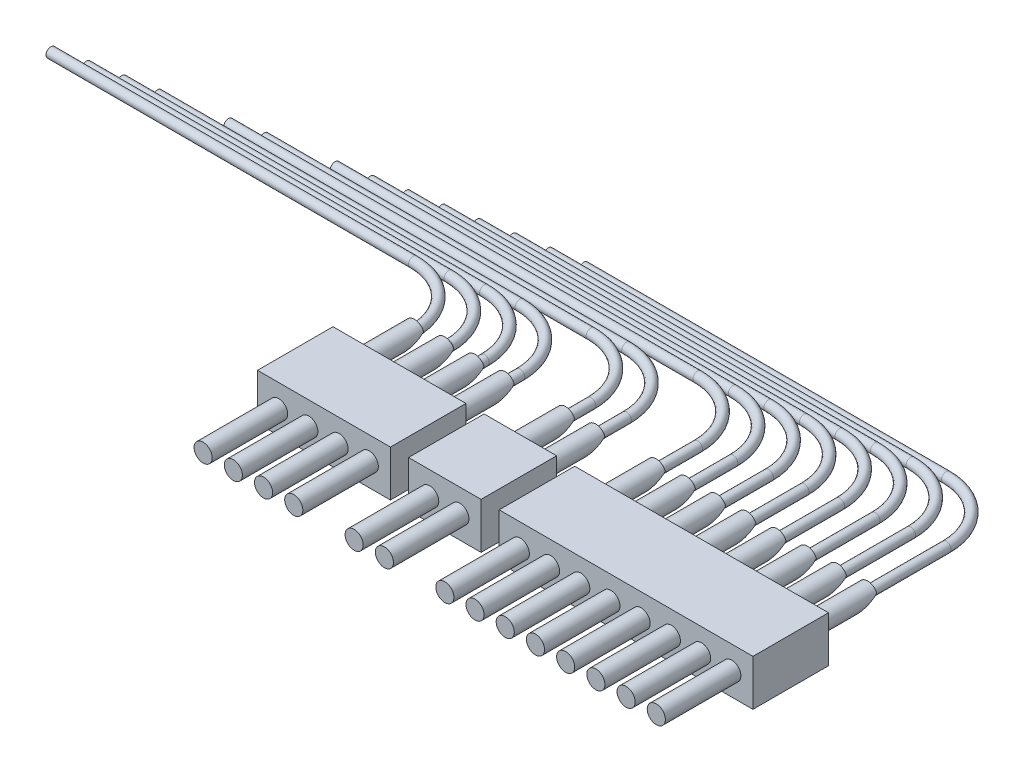
from build123d import *

# Parameters (mm, degrees)
SKETCH1_W               = 20.828
SKETCH1_H               = 3.175
BOSS_EXTRUDE1_DEPTH     = 0.9652
LPATTERN1_COUNT         = 17
LPATTERN1_PITCH         = 1.27
CUT_EXTRUDE2_DEPTH      = 21.764309693
CUT_EXTRUDE2_DEPTH_BACK = 21.764309693
SKETCH5_R               = 0.2032
LPATTERN2_COUNT         = 17
LPATTERN2_PITCH         = 1.289304
SKETCH6_W               = 0.762
SKETCH6_H               = 7.62
CUT_EXTRUDE1_DEPTH      = 2.54


with BuildPart() as part:
    # Sketch1 → Boss-Extrude1 (new, symmetric)
    with BuildSketch(Plane(origin=(0, 0, 0), x_dir=(1, 0, 0), z_dir=(0, 1, 0))):
        with Locations((-9.525, 1.5875)):
            Rectangle(SKETCH1_W, SKETCH1_H)
    extrude(amount=BOSS_EXTRUDE1_DEPTH, both=True)

    # Sketch3 → Revolve1 (revolve)
    with BuildSketch(Plane(origin=(0, 0, 0), x_dir=(1, 0, 0), z_dir=(0, 1, 0)), mode=Mode.PRIVATE) as revolve1_sk:
        Polygon((0, 5.715), (0.4064, 5.715), (0.4064, 1.016), (0.381, 1.016), (0.381, -3.175), (0, -3.175), align=None)
    revolve1 = revolve(revolve1_sk.sketch.rotate(Axis((0, 0, 2.037124636), (0, 0, 1)), 180), axis=Axis((0, 0, 2.037124636), (0, 0, 1)))

    # LPattern1: Revolve1 ×17, 3 skipped
    with Locations(*[(-i * LPATTERN1_PITCH, 0, 0) for i in range(1, LPATTERN1_COUNT) if i not in (8, 11, 16)]):
        add(revolve1)

    # Sketch7 → Cut-Extrude2 (cut, two sides: drawn at the far end of the back side and taken through both)
    with BuildSketch(Plane(origin=(0, 0, 0), x_dir=(0, 0, -1), z_dir=(1, 0, 0)).offset(-CUT_EXTRUDE2_DEPTH_BACK)):
        Polygon((7.405583766, -0.51965219), (4.560936004, -0.51965219), (7.405583766, 1.122705961), align=None)
    extrude(amount=CUT_EXTRUDE2_DEPTH + CUT_EXTRUDE2_DEPTH_BACK, mode=Mode.SUBTRACT)

    # Sweep1: sweep along a path in Sketch4
    with BuildLine(Plane(origin=(0, 0, 0), x_dir=(1, 0, 0), z_dir=(0, 1, 0))) as sweep1_path:
        Line((0, 4.445), (0, 9.017))
        ThreePointArc((0, 9.017), (-0.743948776, 10.813051224), (-2.54, 11.557))
        Line((-2.54, 11.557), (-17.78, 11.557))
    # Sketch5 → Sweep1 (sweep)
    with BuildSketch(Plane(origin=(0, 0, -4.445), x_dir=(-1, 0, 0), z_dir=(0, 0, -1))):
        Circle(SKETCH5_R)
    sweep1 = sweep(path=sweep1_path.line)

    # LPattern2: Sweep1 ×17, 3 skipped
    with Locations(*[Vector(-0.9848077530122079, 0, 0.1736481776669316) * (i * LPATTERN2_PITCH) for i in range(1, LPATTERN2_COUNT) if i not in (8, 11, 16)]):
        add(sweep1)

    # Sketch6 → Cut-Extrude1 (cut, symmetric)
    with BuildSketch(Plane(origin=(0, 0, 0), x_dir=(1, 0, 0), z_dir=(0, 1, 0))):
        with Locations((-10.16, 2.286)):
            Rectangle(SKETCH6_W, SKETCH6_H)
        with Locations((-13.97, 2.286)):
            Rectangle(SKETCH6_W, SKETCH6_H)
    extrude(amount=CUT_EXTRUDE1_DEPTH, both=True, mode=Mode.SUBTRACT)


with BuildPart() as cut_extrude1_piece_1:
    # of the separate pieces the step leaves, piece 1, a body of its own (cut_extrude1_pieces)
    add(part.part.solids().sort_by_distance((-9.779, -0.9652, -3.175))[0])


with BuildPart() as cut_extrude1_piece_2:
    # of the separate pieces the step leaves, piece 2, a body of its own (cut_extrude1_pieces)
    add(part.part.solids().sort_by_distance((-19.939, -0.9652, -3.175))[0])


with BuildPart() as cut_extrude1_piece_3:
    # of the separate pieces the step leaves, piece 3, a body of its own (cut_extrude1_pieces)
    add(part.part.solids().sort_by_distance((-13.589, -0.9652, -3.175))[0])


solid = Compound([cut_extrude1_piece_1.part, cut_extrude1_piece_2.part, cut_extrude1_piece_3.part])
